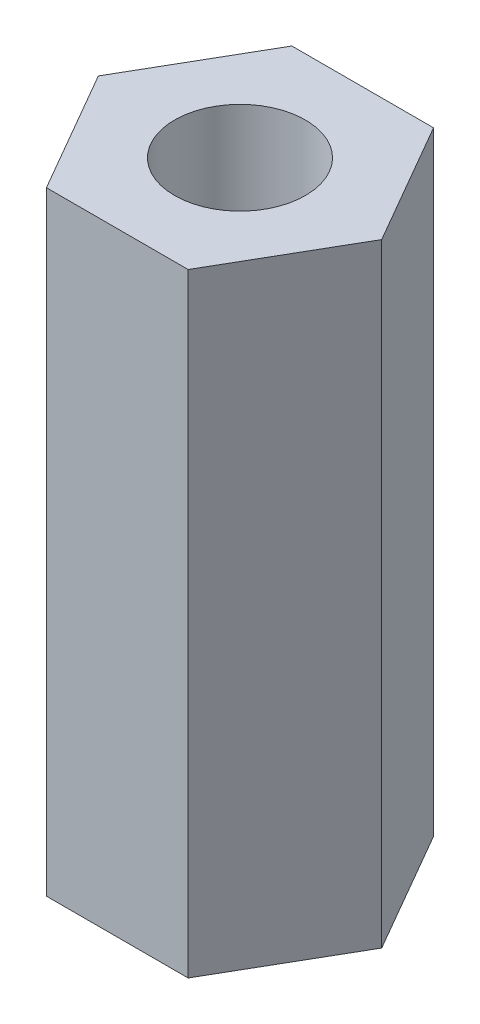
from build123d import *

# Parameters (mm, degrees)
SKETCH_1_R      = 1.6
EXTRUDE_1_DEPTH = 15


with BuildPart() as part:
    # 草图1 → 凸台-拉伸1 (new body)
    with BuildSketch(Plane(origin=(0, 0, 0), x_dir=(1, 0, 0), z_dir=(0, 1, 0))):
        Polygon((3.464101615, 0), (1.732050808, 3), (-1.732050808, 3), (-3.464101615, 0), (-1.732050808, -3), (1.732050808, -3), align=None)
        with Locations(Location((0, 0, 0), (0, 0, 270))):
            Circle(SKETCH_1_R, mode=Mode.SUBTRACT)
    extrude(amount=EXTRUDE_1_DEPTH)


solid = part.part
